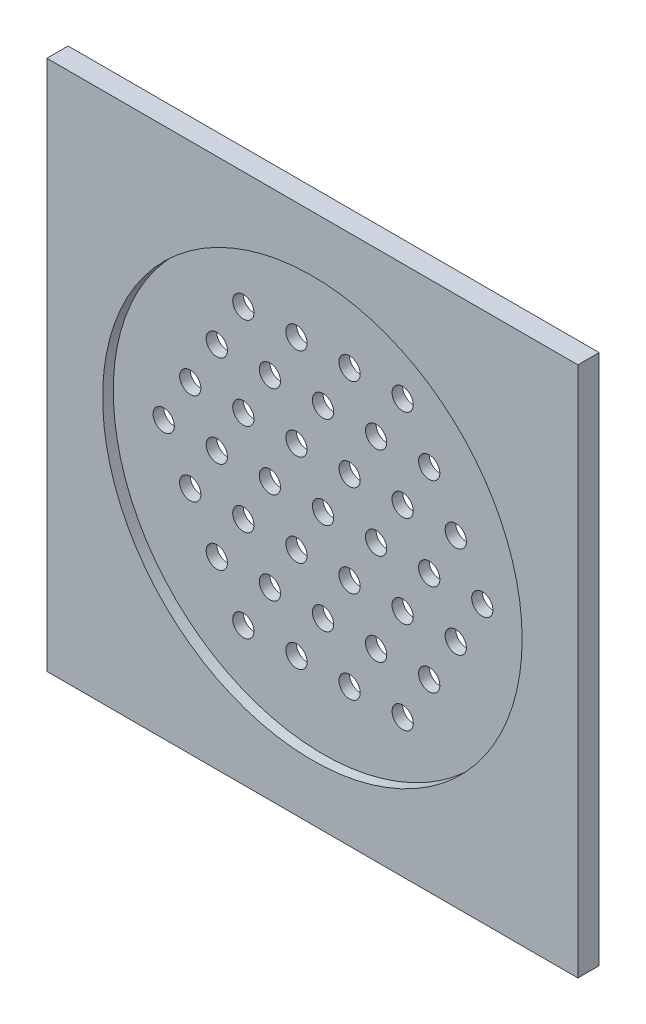
from build123d import *

# Parameters (mm, degrees)
SKETCH_1_W             = 50
SKETCH_1_H             = 50
EXTRUDE_1_DEPTH        = 2
SKETCH_2_R             = 1
CUT_EXTRUDE_1685_DEPTH = 71.738956735
SKETCH_3_R             = 19.75
CUT_EXTRUDE_2158_DEPTH = 1


with BuildPart() as part:
    # Эскиз1 → Бобышка-Вытянуть1 (new body)
    with BuildSketch(Plane(origin=(0, 66.754264805, 0), x_dir=(-1, 0, 0), z_dir=(0, 0, 1))):
        with Locations((25, 41.754264805)):
            Rectangle(SKETCH_1_W, SKETCH_1_H)
    extrude(amount=EXTRUDE_1_DEPTH)

    # Эскиз2 → Cut-Extrude 1685 (cut, through all)
    with BuildSketch(Plane.XY.offset(2)):
        with Locations((-25, 25)):
            Circle(SKETCH_2_R)
        with Locations((-20, 25)):
            Circle(SKETCH_2_R)
        with Locations((-15, 25)):
            Circle(SKETCH_2_R)
        with Locations((-10, 25)):
            Circle(SKETCH_2_R)
        with Locations((-22.5, 20.669872981)):
            Circle(SKETCH_2_R)
        with Locations((-20, 16.339745962)):
            Circle(SKETCH_2_R)
        with Locations((-17.5, 12.009618943)):
            Circle(SKETCH_2_R)
        with Locations((-27.5, 20.669872981)):
            Circle(SKETCH_2_R)
        with Locations((-30, 16.339745962)):
            Circle(SKETCH_2_R)
        with Locations((-32.5, 12.009618943)):
            Circle(SKETCH_2_R)
        with Locations((-30, 25)):
            Circle(SKETCH_2_R)
        with Locations((-35, 25)):
            Circle(SKETCH_2_R)
        with Locations((-40, 25)):
            Circle(SKETCH_2_R)
        with Locations((-27.5, 29.330127019)):
            Circle(SKETCH_2_R)
        with Locations((-30, 33.660254038)):
            Circle(SKETCH_2_R)
        with Locations((-32.5, 37.990381057)):
            Circle(SKETCH_2_R)
        with Locations((-22.5, 29.330127019)):
            Circle(SKETCH_2_R)
        with Locations((-20, 33.660254038)):
            Circle(SKETCH_2_R)
        with Locations((-17.5, 37.990381057)):
            Circle(SKETCH_2_R)
        with Locations((-25, 16.339745962)):
            Circle(SKETCH_2_R)
        with Locations((-27.5, 12.009618943)):
            Circle(SKETCH_2_R)
        with Locations((-22.5, 12.009618943)):
            Circle(SKETCH_2_R)
        with Locations((-32.5, 20.669872981)):
            Circle(SKETCH_2_R)
        with Locations((-37.5, 20.669872981)):
            Circle(SKETCH_2_R)
        with Locations((-35, 16.339745962)):
            Circle(SKETCH_2_R)
        with Locations((-32.5, 29.330127019)):
            Circle(SKETCH_2_R)
        with Locations((-35, 33.660254038)):
            Circle(SKETCH_2_R)
        with Locations((-37.5, 29.330127019)):
            Circle(SKETCH_2_R)
        with Locations((-25, 33.660254038)):
            Circle(SKETCH_2_R)
        with Locations((-22.5, 37.990381057)):
            Circle(SKETCH_2_R)
        with Locations((-27.5, 37.990381057)):
            Circle(SKETCH_2_R)
        with Locations((-17.5, 29.330127019)):
            Circle(SKETCH_2_R)
        with Locations((-12.5, 29.330127019)):
            Circle(SKETCH_2_R)
        with Locations((-15, 33.660254038)):
            Circle(SKETCH_2_R)
        with Locations((-17.5, 20.669872981)):
            Circle(SKETCH_2_R)
        with Locations((-15, 16.339745962)):
            Circle(SKETCH_2_R)
        with Locations((-12.5, 20.669872981)):
            Circle(SKETCH_2_R)
    extrude(amount=-CUT_EXTRUDE_1685_DEPTH, mode=Mode.SUBTRACT)

    # Эскиз3 → Cut-Extrude 2158 (cut)
    with BuildSketch(Plane.XY.offset(2)):
        with Locations((-25, 25)):
            Circle(SKETCH_3_R)
    extrude(amount=-CUT_EXTRUDE_2158_DEPTH, mode=Mode.SUBTRACT)


solid = part.part
